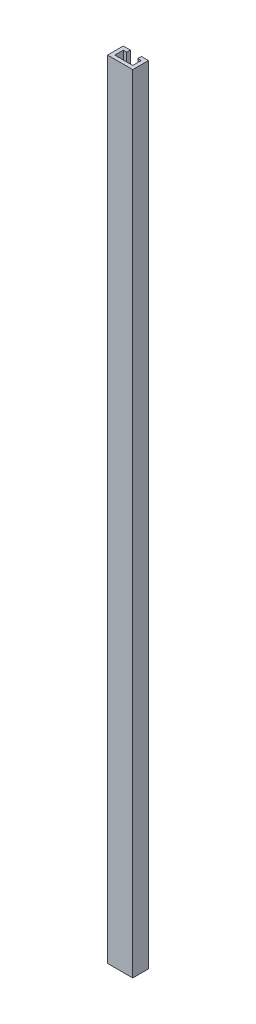
from build123d import *

# Parameters (mm, degrees)
EXTRUDE_1_DEPTH = 250


with BuildPart() as part:
    # 草图1 → 凸台-拉伸1 (new body)
    with BuildSketch(Plane(origin=(0, 0, 0), x_dir=(1, 0, 0), z_dir=(0, 1, 0))):
        Polygon((0, -5), (8, -5), (8, 0), (5.75, 0), (5.75, -1.15), (6.85, -1.15), (6.85, -3.85), (1.15, -3.85), (1.15, -1.15), (2.25, -1.15), (2.25, 0), (0, 0), align=None)
    extrude(amount=EXTRUDE_1_DEPTH)


solid = part.part
